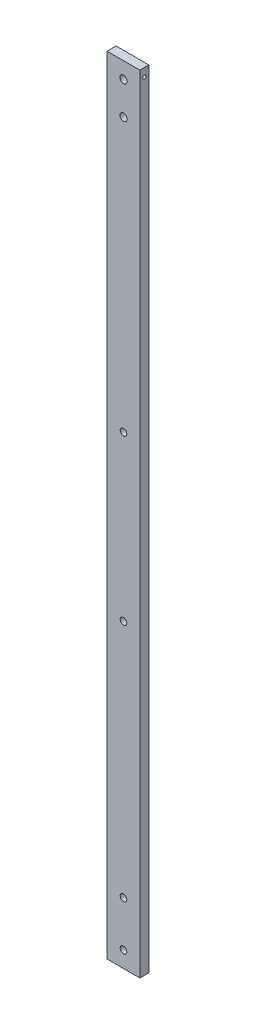
from build123d import *

# Parameters (mm, degrees)
SKETCH1_W           = 25.4
SKETCH1_H           = 609.6
SKETCH1_R           = 2.5527
SKETCH1_R_2         = 2.794
BOSS_EXTRUDE1_DEPTH = 7
SKETCH2_R           = 1.33338173
CUT_EXTRUDE1_DEPTH  = 306.936594738
SKETCH3_R           = 2.5527
CUT_EXTRUDE2_DEPTH  = 306.144768921


with BuildPart() as part:
    # Sketch1 → Boss-Extrude1 (new body)
    with BuildSketch(Plane.XY):
        Rectangle(SKETCH1_W, SKETCH1_H)
        with Locations((0, -257.3)):
            Circle(SKETCH1_R, mode=Mode.SUBTRACT)
        with Locations((0, -292.3)):
            Circle(SKETCH1_R, mode=Mode.SUBTRACT)
        with Locations((0, 292.2999996)):
            Circle(SKETCH1_R_2, mode=Mode.SUBTRACT)
        with Locations((0, 266.8999996)):
            Circle(SKETCH1_R_2, mode=Mode.SUBTRACT)
    extrude(amount=BOSS_EXTRUDE1_DEPTH)

    # Sketch2 → Cut-Extrude1 (cut, through all)
    with BuildSketch(Plane(origin=(12.7, 0, 0), x_dir=(0, 0, -1), z_dir=(1, 0, 0))):
        with Locations((-3.5, 298.45)):
            Circle(SKETCH2_R)
    extrude(amount=-CUT_EXTRUDE1_DEPTH, mode=Mode.SUBTRACT)

    # Sketch3 → Cut-Extrude2 (cut, through all)
    with BuildSketch(Plane(origin=(0, 0, 0), x_dir=(-1, 0, 0), z_dir=(0, 0, -1))):
        with Locations((0, -71.6)):
            Circle(SKETCH3_R)
        with Locations((0, 55.4)):
            Circle(SKETCH3_R)
    extrude(amount=-CUT_EXTRUDE2_DEPTH, mode=Mode.SUBTRACT)


solid = part.part
